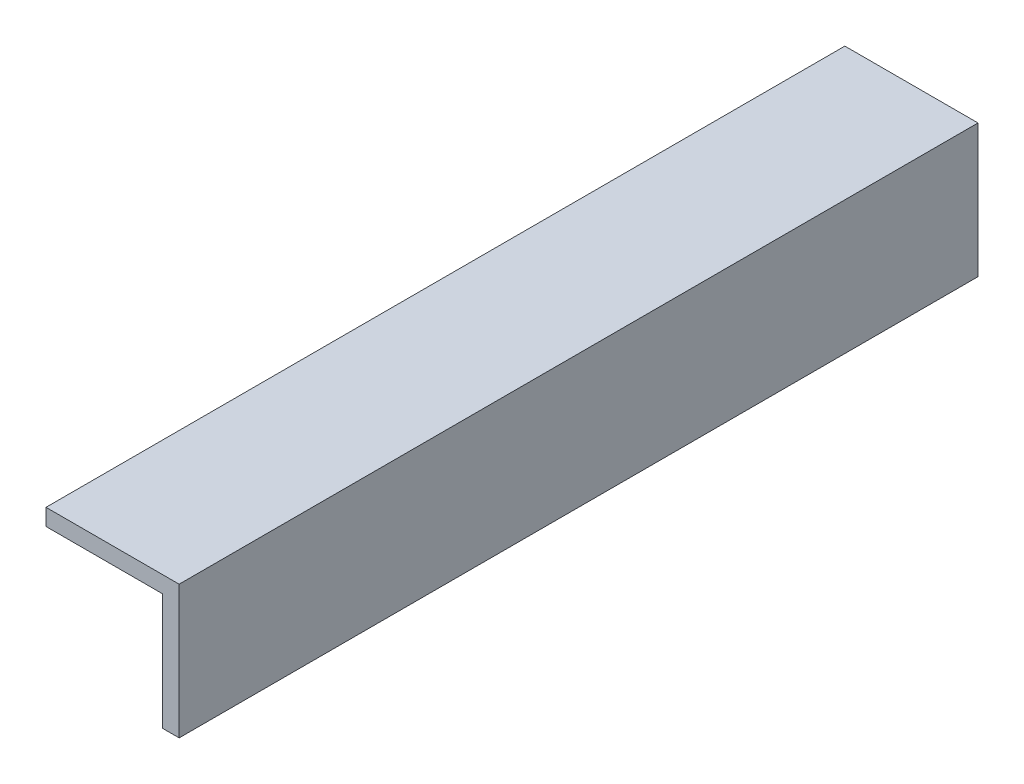
from build123d import *

# Parameters (mm, degrees)
BOSS_EXTRUDE1_DEPTH = 152.4


with BuildPart() as part:
    # Sketch1 → Boss-Extrude1 (new body)
    with BuildSketch(Plane.XY):
        Polygon((0, 0), (25.4, 0), (25.4, -25.4), (22.225, -25.4), (22.225, -3.175), (0, -3.175), align=None)
    extrude(amount=BOSS_EXTRUDE1_DEPTH)


solid = part.part
